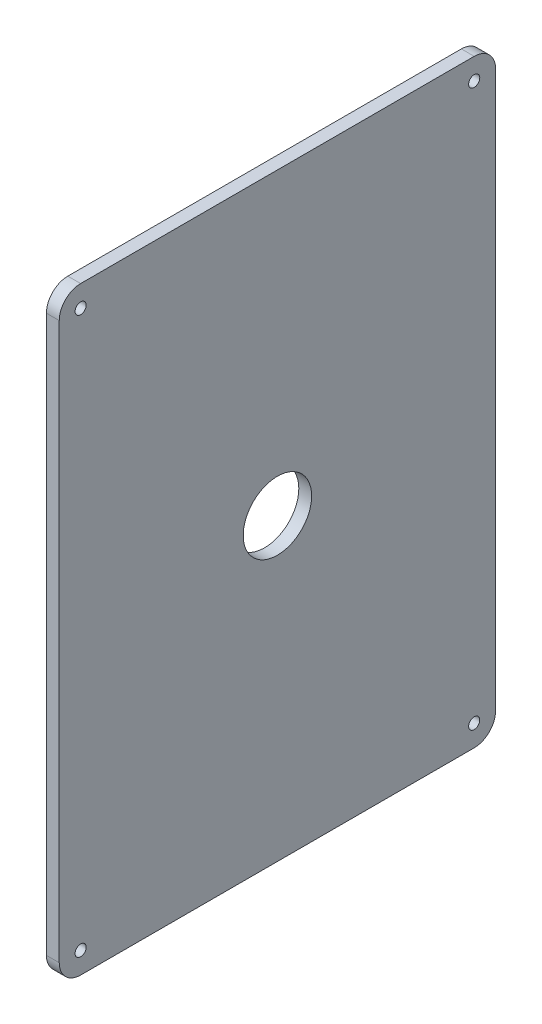
from build123d import *

# Parameters (mm, degrees)
SKETCH1_W           = 102
SKETCH1_H           = 140
BOSS_EXTRUDE1_DEPTH = 3
FILLET1_R           = 5
CUT_EXTRUDE1_DEPTH  = 3
SKETCH3_R           = 1.3
CUT_EXTRUDE2_DEPTH  = 100


with BuildPart() as part:
    # Sketch1 → Boss-Extrude1 (new body)
    with BuildSketch(Plane(origin=(0, 0, 0), x_dir=(0, 0, -1), z_dir=(1, 0, 0))):
        with Locations((51, -70)):
            Rectangle(SKETCH1_W, SKETCH1_H)
    extrude(amount=BOSS_EXTRUDE1_DEPTH)

    # Fillet1
    fillet1_edges = [part.edges().sort_by_distance(p)[0] for p in [
        (1.5, 0, 0),
        (1.5, 0, -102),
        (1.5, -140, -102),
        (1.5, -140, 0),
    ]]
    fillet(fillet1_edges, radius=FILLET1_R)

    # Sketch2 → Cut-Extrude1 (cut)
    with BuildSketch(Plane(origin=(3, 0, 0), x_dir=(0, 0, -1), z_dir=(1, 0, 0))):
        with BuildLine():
            ThreePointArc((46.313735132, -76.483742869), (51, -78), (55.686264868, -76.483742869))
            Line((55.686264868, -76.483742869), (51, -70))
            Line((51, -70), (46.313735132, -76.483742869))
        make_face()
        with BuildLine():
            Line((51, -70), (55.686264868, -76.483742869))
            ThreePointArc((55.686264868, -76.483742869), (58.123556659, -73.640733515), (59, -70))
            ThreePointArc((59, -70), (58.123556659, -66.359266485), (55.686264868, -63.516257131))
            Line((55.686264868, -63.516257131), (51, -70))
        make_face()
        with BuildLine():
            Line((46.313735132, -76.483742869), (51, -70))
            Line((51, -70), (46.313735132, -63.516257131))
            ThreePointArc((46.313735132, -63.516257131), (43, -70), (46.313735132, -76.483742869))
        make_face()
        with BuildLine():
            Line((46.313735132, -63.516257131), (51, -70))
            Line((51, -70), (55.686264868, -63.516257131))
            ThreePointArc((55.686264868, -63.516257131), (51, -62), (46.313735132, -63.516257131))
        make_face()
    extrude(amount=-CUT_EXTRUDE1_DEPTH, mode=Mode.SUBTRACT)

    # Sketch3 → Cut-Extrude2 (cut)
    with BuildSketch(Plane(origin=(3, 0, 0), x_dir=(0, 0, -1), z_dir=(1, 0, 0))):
        with Locations((5, -135)):
            Circle(SKETCH3_R)
        with Locations((5, -5)):
            Circle(SKETCH3_R)
        with Locations((97, -5)):
            Circle(SKETCH3_R)
        with Locations((97, -135)):
            Circle(SKETCH3_R)
    extrude(amount=-CUT_EXTRUDE2_DEPTH, mode=Mode.SUBTRACT)


solid = part.part
